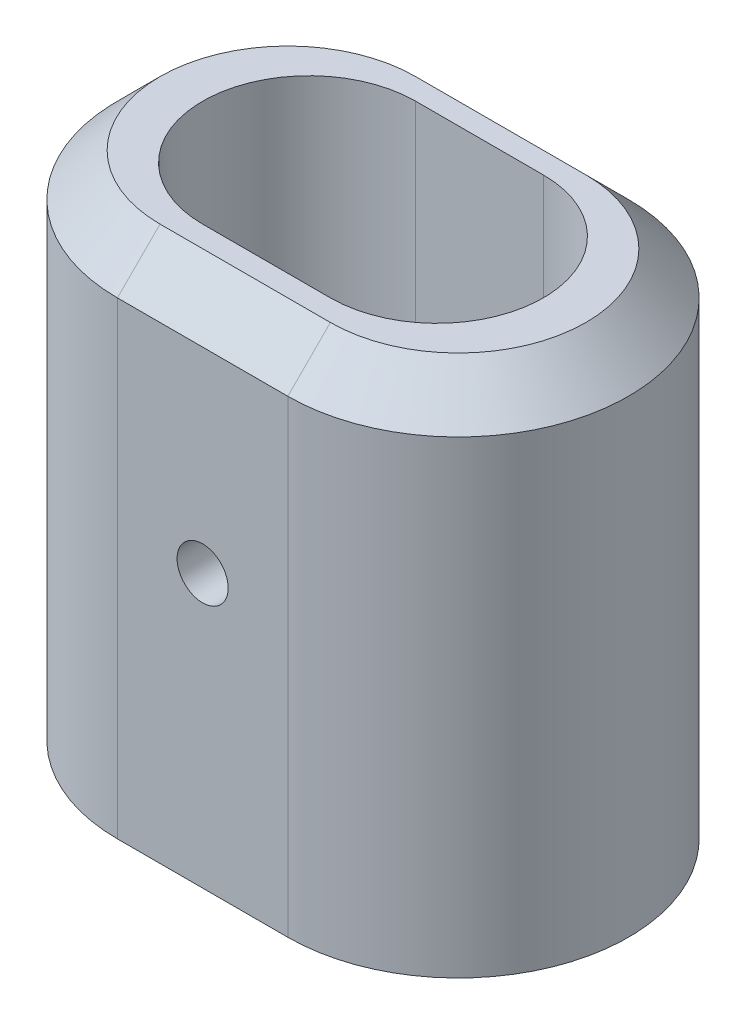
from build123d import *

# Parameters (mm, degrees)
BOSS_EXTRUDE1_DEPTH = 30
CUT_EXTRUDE1_DEPTH  = 71
CHAMFER1_SIZE       = 5
SKETCH5_R           = 3
CUT_EXTRUDE2_DEPTH  = 59.309518948


with BuildPart() as part:
    # Sketch3 → Boss-Extrude1 (new, symmetric)
    with BuildSketch(Plane(origin=(0, 0, 0), x_dir=(1, 0, 0), z_dir=(0, 1, 0))):
        with BuildLine():
            Line((-10, 20), (10, 20))
            ThreePointArc((10, 20), (30, 0), (10, -20))
            Line((10, -20), (-10, -20))
            ThreePointArc((-10, -20), (-30, 0), (-10, 20))
        make_face()
    extrude(amount=BOSS_EXTRUDE1_DEPTH, both=True)

    # Sketch4 → Cut-Extrude1 (cut, through all)
    with BuildSketch(Plane(origin=(0, 30, 0), x_dir=(1, 0, 0), z_dir=(0, 1, 0))):
        with BuildLine():
            Line((-7.5, 12.5), (7.5, 12.5))
            ThreePointArc((7.5, 12.5), (20, 0), (7.5, -12.5))
            Line((7.5, -12.5), (-7.5, -12.5))
            ThreePointArc((-7.5, -12.5), (-20, 0), (-7.5, 12.5))
        make_face()
    extrude(amount=-CUT_EXTRUDE1_DEPTH, mode=Mode.SUBTRACT)

    # Chamfer1
    chamfer1_edges = [part.edges().sort_by_distance(p)[0] for p in [
        (30, 30, 0),
        (0, 30, -20),
        (-30, 30, 0),
        (0, 30, 20),
    ]]
    chamfer(chamfer1_edges, length=CHAMFER1_SIZE)

    # Sketch5 → Cut-Extrude2 (cut, through all)
    with BuildSketch(Plane.XY.offset(20)):
        with Locations((0, 2)):
            Circle(SKETCH5_R)
    extrude(amount=-CUT_EXTRUDE2_DEPTH, mode=Mode.SUBTRACT)


solid = part.part
